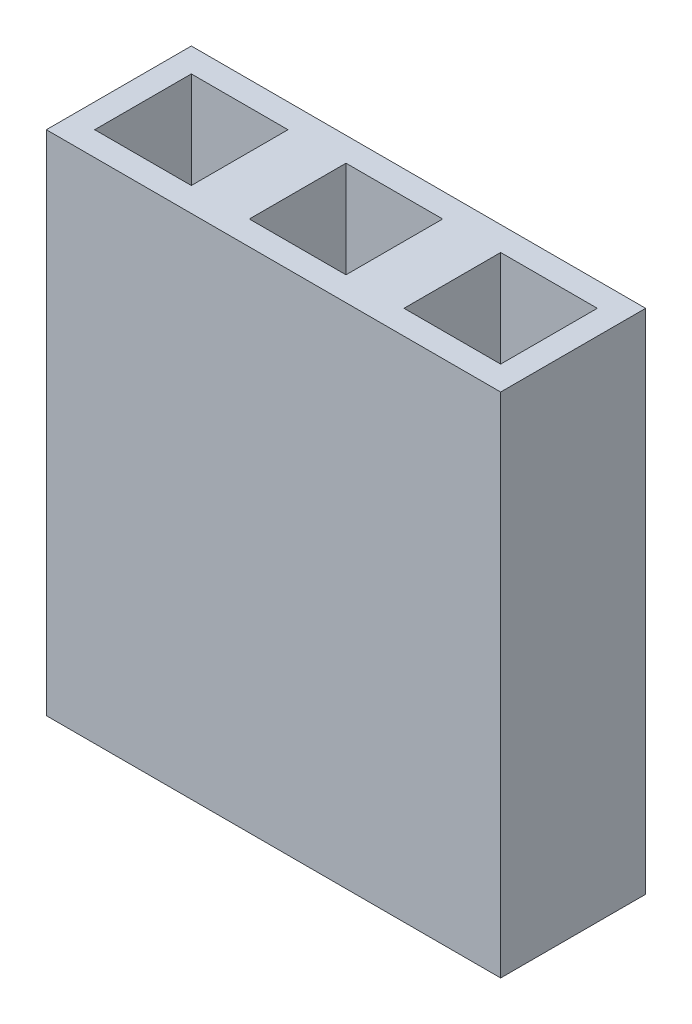
from build123d import *

# Parameters (mm, degrees)
ESBO_O1_W                = 38.4
ESBO_O1_H                = 8.4
RESSALTO_EXTRUS_O1_DEPTH = 2.4
ESBO_O2_W                = 1.6
ESBO_O2_H                = 1.6
CORTE_EXTRUS_O1_DEPTH    = 2.5
PADR_O_LINEAR1_COUNT     = 16
PADR_O_LINEAR1_PITCH     = 2.56
ESBO_O3_R                = 0.51
CORTE_EXTRUS_O2_DEPTH    = 21.228939666
PADR_O_LINEAR2_COUNT     = 15
PADR_O_LINEAR2_PITCH     = 2.543
ESBO_O6_W                = 18.080220827
ESBO_O6_H                = 8.4
CORTE_EXTRUS_O3_DEPTH    = 10
ESBO_O8_W                = 12.799779173
ESBO_O8_H                = 8.4
CORTE_EXTRUS_O4_DEPTH    = 10


with BuildPart() as part:
    # Esboço1 → Ressalto-extrusão1 (new body)
    with BuildSketch(Plane.XY):
        Rectangle(ESBO_O1_W, ESBO_O1_H)
    extrude(amount=RESSALTO_EXTRUS_O1_DEPTH)

    # Esboço2 → Corte-extrusão1 (cut)
    with BuildSketch(Plane(origin=(0, 4.2, 0), x_dir=(1, 0, 0), z_dir=(0, 1, 0))):
        with Locations((-18, -1.2)):
            Rectangle(ESBO_O2_W, ESBO_O2_H)
    corte_extrus_o1 = extrude(amount=-CORTE_EXTRUS_O1_DEPTH, mode=Mode.SUBTRACT)

    # Padrão linear1: Corte-extrusão1 ×16
    with Locations(*[(i * PADR_O_LINEAR1_PITCH, 0, 0) for i in range(1, PADR_O_LINEAR1_COUNT)]):
        add(corte_extrus_o1, mode=Mode.SUBTRACT)

    # Esboço3 → Corte-extrusão2 (cut, through all)
    with BuildSketch(Plane(origin=(0, 1.7, 0), x_dir=(1, 0, 0), z_dir=(0, 1, 0))):
        with Locations(Location((-18, -1.2, 0), (0, 0, 270))):
            Circle(ESBO_O3_R)
    corte_extrus_o2 = extrude(amount=-CORTE_EXTRUS_O2_DEPTH, mode=Mode.SUBTRACT)

    # Padrão linear2: Corte-extrusão2 ×15
    with Locations(*[(i * PADR_O_LINEAR2_PITCH, 0, 0) for i in range(1, PADR_O_LINEAR2_COUNT)]):
        add(corte_extrus_o2, mode=Mode.SUBTRACT)

    # Esboço6 → Corte-extrusão3 (cut)
    with BuildSketch(Plane.XY.offset(2.4)):
        with Locations((10.159889587, 0)):
            Rectangle(ESBO_O6_W, ESBO_O6_H)
    extrude(amount=-CORTE_EXTRUS_O3_DEPTH, mode=Mode.SUBTRACT)

    # Esboço8 → Corte-extrusão4 (cut)
    with BuildSketch(Plane.XY.offset(2.4)):
        with Locations((-5.280110414, 0)):
            Rectangle(ESBO_O8_W, ESBO_O8_H)
    extrude(amount=-CORTE_EXTRUS_O4_DEPTH, mode=Mode.SUBTRACT)


solid = part.part
